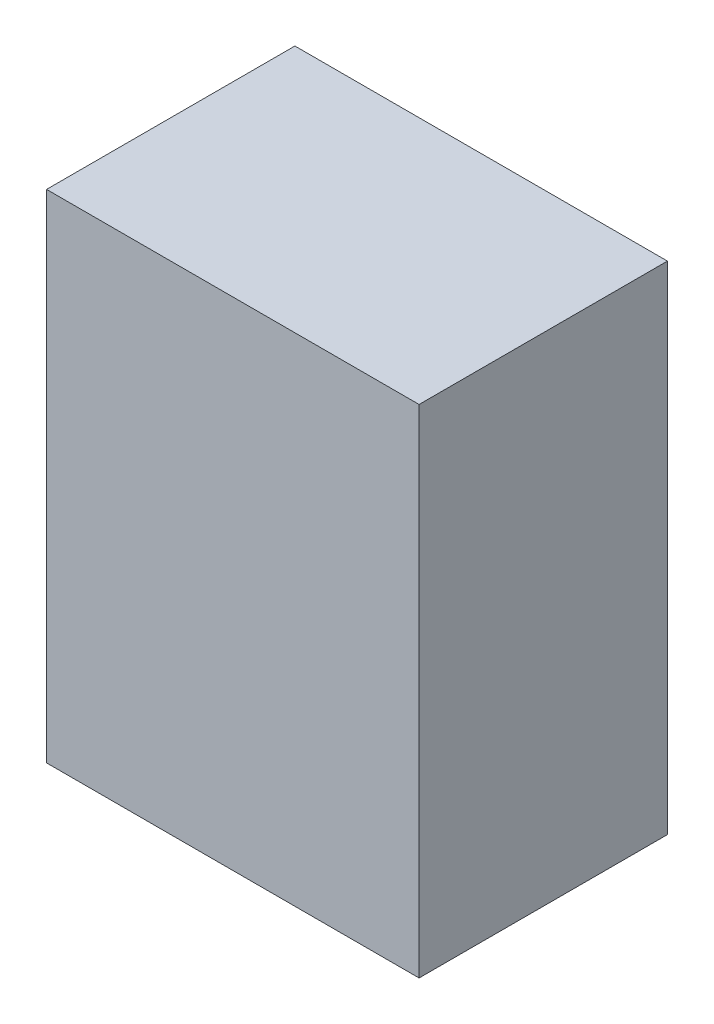
from build123d import *

# Parameters (mm, degrees)
SKETCH_1_W      = 60
SKETCH_1_H      = 80
EXTRUDE_1_DEPTH = 20


with BuildPart() as part:
    # ｽｹｯﾁ1 → ﾎﾞｽ - 押し出し1 (new, symmetric)
    with BuildSketch(Plane.XY):
        Rectangle(SKETCH_1_W, SKETCH_1_H)
    extrude(amount=EXTRUDE_1_DEPTH, both=True)


solid = part.part
